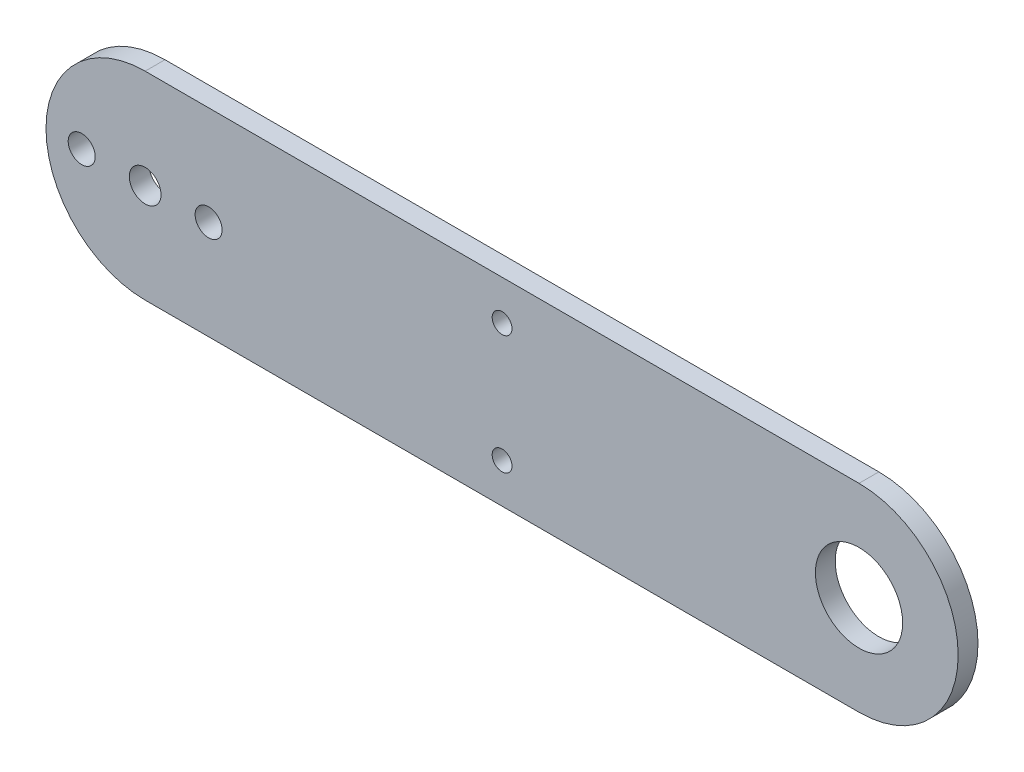
from build123d import *

# Parameters (mm, degrees)
SKETCH1_R           = 4
SKETCH1_R_2         = 3.4
SKETCH1_R_3         = 11
BOSS_EXTRUDE3_DEPTH = 5
SKETCH2_R           = 2.5
CUT_EXTRUDE1_DEPTH  = 10


with BuildPart() as part:
    # Sketch1 → Boss-Extrude3 (new body)
    with BuildSketch(Plane.XY):
        with BuildLine():
            Line((0, 25), (180, 25))
            ThreePointArc((180, 25), (205, 0), (180, -25))
            Line((180, -25), (0, -25))
            ThreePointArc((0, -25), (-25, 0), (0, 25))
        make_face()
        Circle(SKETCH1_R, mode=Mode.SUBTRACT)
        with Locations((-16, 0)):
            Circle(SKETCH1_R_2, mode=Mode.SUBTRACT)
        with Locations((16, 0)):
            Circle(SKETCH1_R_2, mode=Mode.SUBTRACT)
        with Locations((180, 0)):
            Circle(SKETCH1_R_3, mode=Mode.SUBTRACT)
    extrude(amount=BOSS_EXTRUDE3_DEPTH)

    # Sketch2 → Cut-Extrude1 (cut)
    with BuildSketch(Plane.XY.offset(5)):
        with Locations((90, 15)):
            Circle(SKETCH2_R)
        with Locations((90, -15)):
            Circle(SKETCH2_R)
    extrude(amount=-CUT_EXTRUDE1_DEPTH, mode=Mode.SUBTRACT)


solid = part.part
